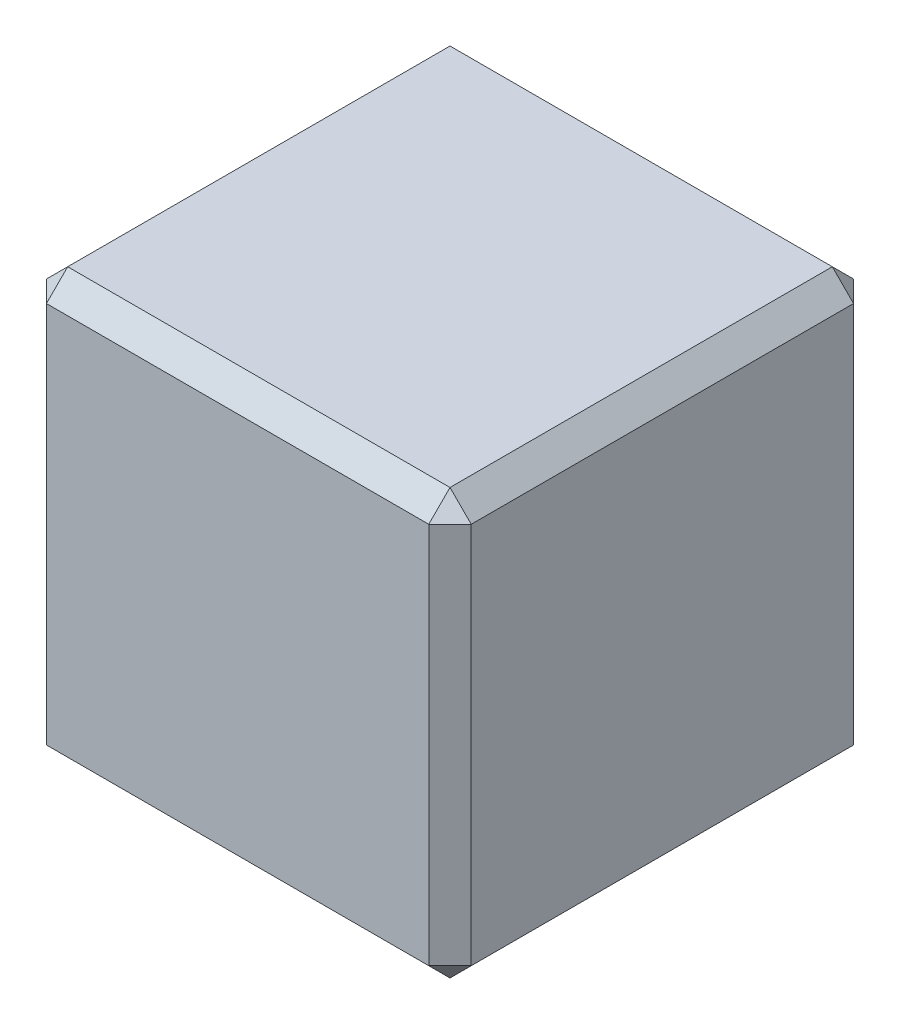
from build123d import *

# Parameters (mm, degrees)
SKETCH1_W           = 20
SKETCH1_H           = 20
BOSS_EXTRUDE1_DEPTH = 20
CHAMFER1_SIZE       = 1


with BuildPart() as part:
    # Sketch1 → Boss-Extrude1 (new body)
    with BuildSketch(Plane.XY):
        with Locations((10, 10)):
            Rectangle(SKETCH1_W, SKETCH1_H)
    extrude(amount=BOSS_EXTRUDE1_DEPTH)

    # Chamfer1
    chamfer1_edges = [part.edges().sort_by_distance(p)[0] for p in [
        (20, 10, 20),
        (10, 20, 20),
        (0, 10, 20),
        (10, 20, 0),
        (20, 10, 0),
        (10, 0, 0),
        (0, 10, 0),
        (0, 20, 10),
        (20, 20, 10),
        (20, 0, 10),
        (0, 0, 10),
        (10, 0, 20),
    ]]
    chamfer(chamfer1_edges, length=CHAMFER1_SIZE)


solid = part.part
